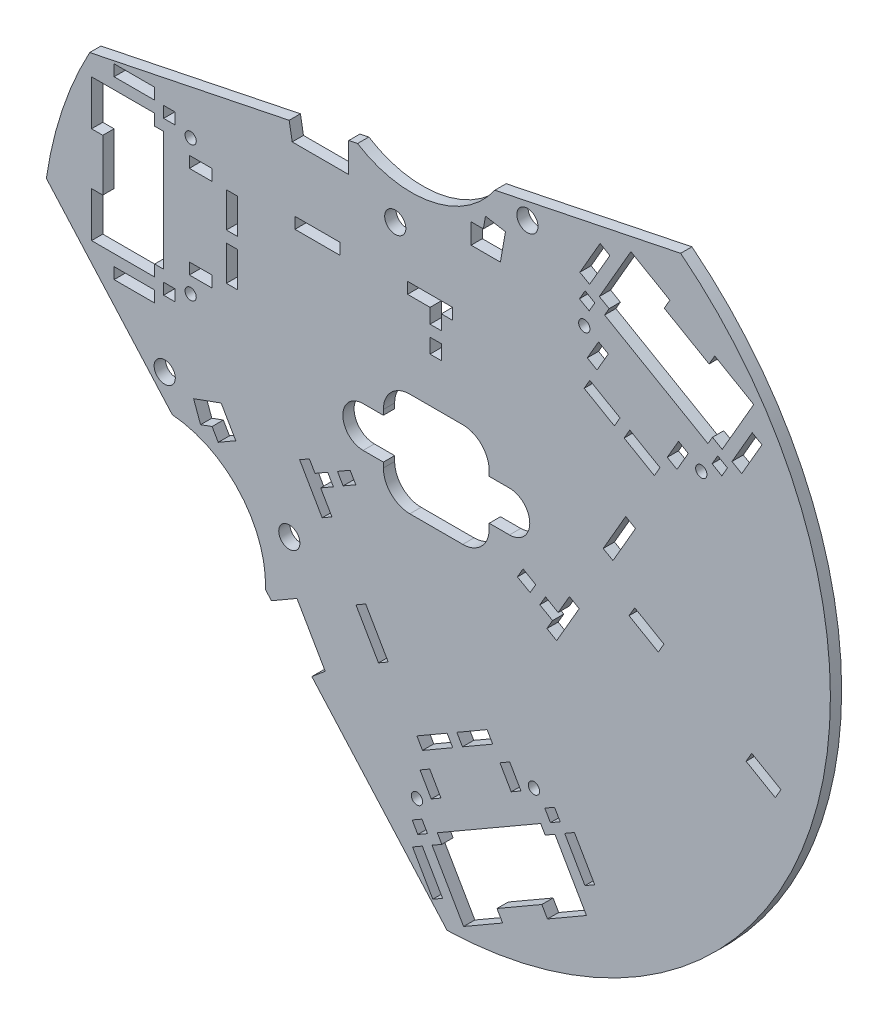
from build123d import *

# Parameters (mm, degrees)
ESQUISSE1_R             = 175
BOSS_EXTRU_1_DEPTH      = 5
ESQUISSE2_W             = 5
ESQUISSE2_H             = 6.5
ESQUISSE2_W_2           = 20
ESQUISSE2_H_2           = 5
ESQUISSE2_H_3           = 15.5
ESQUISSE2_W_3           = 10
ESQUISSE2_W_4           = 18
ESQUISSE2_H_4           = 20
ENL_V_MAT_EXTRU_1_DEPTH = 5
ENL_V_MAT_EXTRU_2_DEPTH = 5
ESQUISSE4_R             = 2.5
ENL_V_MAT_EXTRU_3_DEPTH = 5
ESQUISSE5_R             = 4.7
ENL_V_MAT_EXTRU_4_DEPTH = 5
BOSS_EXTRU_2_DEPTH      = 5
ENL_V_MAT_EXTRU_5_DEPTH = 5
ENL_V_MAT_EXTRU_6_DEPTH = 10


with BuildPart() as part:
    # Esquisse1 → Boss.-Extru.1 (new body)
    with BuildSketch(Plane.XY):
        with Locations((148.080426897, -12.110171348)):
            Circle(ESQUISSE1_R)
    extrude(amount=BOSS_EXTRU_1_DEPTH)

    # Esquisse2 → Enlèv. mat.-Extru.1 (cut)
    with BuildSketch(Plane(origin=(0, 0, 0), x_dir=(-1, 0, 0), z_dir=(0, 0, -1))):
        Polygon((-155.311788567, 53.777441362), (-135.311788567, 53.777441362), (-135.311788567, 48.777441362), (-145.311788567, 48.777441362), (-145.311788567, 42.277441362), (-150.311788567, 42.277441362), (-150.311788567, 48.777441362), (-155.311788567, 48.777441362), align=None)
        with Locations((-147.811788567, 34.027441362)):
            Rectangle(ESQUISSE2_W, ESQUISSE2_H)
        with Locations((-95.311788567, 51.277441362)):
            Rectangle(ESQUISSE2_W_2, ESQUISSE2_H_2)
        with Locations((-57.36, 41.027441362)):
            Rectangle(ESQUISSE2_W, ESQUISSE2_H_3)
        with Locations((-57.36, 20.527441362)):
            Rectangle(ESQUISSE2_W, ESQUISSE2_H_3)
        with Locations((-43.43, 10.277441362)):
            Rectangle(ESQUISSE2_W_3, ESQUISSE2_H_2)
        with Locations((-29.5, -3.222558638)):
            Rectangle(ESQUISSE2_W, ESQUISSE2_H_2)
        with Locations((-14, -8.222558638)):
            Rectangle(ESQUISSE2_W_4, ESQUISSE2_H_2)
        with Locations((2.5, 9.277441362)):
            Rectangle(ESQUISSE2_W, ESQUISSE2_H_4)
        with Locations((2.5, 52.277441362)):
            Rectangle(ESQUISSE2_W, ESQUISSE2_H_4)
        with Locations((-14, 69.777441362)):
            Rectangle(ESQUISSE2_W_4, ESQUISSE2_H_2)
        with Locations((-29.5, 64.777441362)):
            Rectangle(ESQUISSE2_W, ESQUISSE2_H_2)
        with Locations((-43.43, 51.277441362)):
            Rectangle(ESQUISSE2_W_3, ESQUISSE2_H_2)
        Polygon((-87.404399659, -38.791434793), (-97.404399659, -56.111942869), (-101.734526678, -53.611942869), (-96.734526678, -44.951688831), (-102.363691803, -41.701688831), (-99.863691803, -37.371561812), (-94.234526678, -40.621561812), (-91.734526678, -36.291434793), align=None)
        Polygon((-104.193818822, -34.871561812), (-106.693818822, -39.201688831), (-112.322983946, -35.951688831), (-109.822983946, -31.621561812), align=None)
        Polygon((-112.404399659, -82.092704982), (-122.404399659, -99.413213058), (-126.734526678, -96.913213058), (-116.734526678, -79.592704982), align=None)
        Polygon((-139.460420962, -118.955108529), (-141.960420962, -123.285235548), (-155.38381472, -115.535235548), (-152.88381472, -111.205108529), align=None)
        Polygon((-157.213941739, -108.705108529), (-159.713941739, -113.035235548), (-173.137335498, -105.285235548), (-170.637335498, -100.955108529), align=None)
        Polygon((-176.352335498, -110.853778894), (-181.352335498, -119.514032932), (-185.682462517, -117.014032932), (-180.682462517, -108.353778894), align=None)
        Polygon((-196.258678449, -118.332576278), (-198.758678449, -122.662703297), (-203.088805468, -120.162703297), (-200.588805468, -115.832576278), align=None)
        Polygon((-205.088805468, -123.626804912), (-214.088805468, -139.215262181), (-218.418932487, -136.715262181), (-209.418932487, -121.126804912), align=None)
        Polygon((-212.258678449, -146.045389199), (-214.758678449, -150.375516218), (-197.438170373, -160.375516218), (-194.938170373, -156.045389199), align=None)
        Polygon((-175.019586086, -167.545389199), (-177.519586086, -171.875516218), (-160.199078011, -181.875516218), (-157.699078011, -177.545389199), align=None)
        Polygon((-141.868950992, -160.126804912), (-150.868950992, -175.715262181), (-146.538823973, -178.215262181), (-137.538823973, -162.626804912), align=None)
        Polygon((-139.868950992, -156.662703297), (-137.368950992, -152.332576278), (-141.699078011, -149.832576278), (-144.199078011, -154.162703297), align=None)
        Polygon((-145.845293943, -140.014032932), (-140.845293943, -131.353778894), (-145.175420962, -128.853778894), (-150.175420962, -137.514032932), align=None)
        Polygon((-201.525092463, -51.316520615), (-211.525092463, -33.996012539), (-207.194965444, -31.496012539), (-202.194965444, -40.156266577), (-196.56580032, -36.906266577), (-194.06580032, -41.236393596), (-199.694965444, -44.486393596), (-197.194965444, -48.816520615), align=None)
        Polygon((-189.735673301, -38.736393596), (-192.235673301, -34.406266577), (-186.606508176, -31.156266577), (-184.106508176, -35.486393596), align=None)
        Polygon((-226.525092463, -8.015250425), (-236.525092463, 9.30525765), (-232.194965444, 11.80525765), (-222.194965444, -5.515250425), align=None)
        Polygon((-244.920859728, 33.847153121), (-247.420859728, 38.17728014), (-233.997465969, 45.92728014), (-231.497465969, 41.597153121), align=None)
        Polygon((-227.16733895, 44.097153121), (-229.66733895, 48.42728014), (-216.243945192, 56.17728014), (-213.743945192, 51.847153121), align=None)
        Polygon((-219.458945192, 61.745823487), (-224.458945192, 70.406077524), (-220.128818173, 72.906077524), (-215.128818173, 64.245823487), align=None)
        Polygon((-215.982602241, 82.724620871), (-218.482602241, 87.05474789), (-214.152475222, 89.55474789), (-211.652475222, 85.224620871), align=None)
        Polygon((-216.152475222, 93.018849505), (-225.152475222, 108.607306773), (-220.822348203, 111.107306773), (-211.822348203, 95.518849505), align=None)
        Polygon((-231.982602241, 110.437433792), (-234.482602241, 114.767560811), (-251.803110316, 104.767560811), (-249.303110316, 100.437433792), align=None)
        Polygon((-269.221694603, 88.937433792), (-271.721694603, 93.267560811), (-289.042202679, 83.267560811), (-286.542202679, 78.937433792), align=None)
        Polygon((-279.372329698, 56.518849505), (-288.372329698, 72.107306773), (-292.702456717, 69.607306773), (-283.702456717, 54.018849505), align=None)
        Polygon((-277.372329698, 53.05474789), (-274.872329698, 48.724620871), (-270.542202679, 51.224620871), (-273.042202679, 55.55474789), align=None)
        Polygon((-259.965986747, 49.906077524), (-254.965986747, 41.245823487), (-250.635859728, 43.745823487), (-255.635859728, 52.406077524), align=None)
    extrude(amount=-ENL_V_MAT_EXTRU_1_DEPTH, mode=Mode.SUBTRACT)

    # Esquisse3 → Enlèv. mat.-Extru.2 (cut)
    with BuildSketch(Plane(origin=(0, 0, 0), x_dir=(-1, 0, 0), z_dir=(0, 0, -1))):
        Polygon((0, -0.722558638), (-23, -0.722558638), (-23, 4.277441362), (-27, 4.277441362), (-27, 57.277441362), (-23, 57.277441362), (-23, 62.277441362), (0, 62.277441362), align=None)
        Polygon((-212.258678449, -146.045389199), (-200.758678449, -126.126804912), (-196.42855143, -128.626804912), (-194.42855143, -125.162703297), (-148.52920503, -151.662703297), (-150.52920503, -155.126804912), (-146.199078011, -157.626804912), (-157.699078011, -177.545389199), align=None)
        Polygon((-231.982602241, 110.437433792), (-220.482602241, 90.518849505), (-224.81272926, 88.018849505), (-222.81272926, 84.55474789), (-268.71207566, 58.05474789), (-270.71207566, 61.518849505), (-275.042202679, 59.018849505), (-286.542202679, 78.937433792), align=None)
    extrude(amount=-ENL_V_MAT_EXTRU_2_DEPTH, mode=Mode.SUBTRACT)

    # Esquisse4 → Enlèv. mat.-Extru.3 (cut)
    with BuildSketch(Plane(origin=(0, 0, 0), x_dir=(-1, 0, 0), z_dir=(0, 0, -1))):
        with Locations((-39, 60.777441362)):
            Circle(ESQUISSE4_R)
        with Locations(Location((-39, 0.777441362, 0), (0, 0, 180))):
            Circle(ESQUISSE4_R)
        with Locations((-139.498116116, -143.020398452)):
            Circle(ESQUISSE4_R)
        with Locations(Location((-191.459640343, -113.020398452, 0), (0, 0, 180))):
            Circle(ESQUISSE4_R)
        with Locations((-265.743164573, 45.912443044)):
            Circle(ESQUISSE4_R)
        with Locations(Location((-213.781640346, 75.912443044, 0), (0, 0, 180))):
            Circle(ESQUISSE4_R)
    extrude(amount=-ENL_V_MAT_EXTRU_3_DEPTH, mode=Mode.SUBTRACT)

    # Esquisse5 → Enlèv. mat.-Extru.4 (cut)
    with BuildSketch(Plane(origin=(0, 0, 0), x_dir=(-1, 0, 0), z_dir=(0, 0, -1))):
        with Locations((-188.54080573, 103.777441362)):
            Circle(ESQUISSE5_R)
        with Locations((-129.859999997, 73.777441362)):
            Circle(ESQUISSE5_R)
        with Locations((-27.488620889, -35.014261787)):
            Circle(ESQUISSE5_R)
        with Locations((-82.809785869, -70.833330267)):
            Circle(ESQUISSE5_R)
        Polygon((9.512961524, 70.443622585), (-93.474910733, 91.632672923), (-94.859999997, 83.777441362), (-174.859999997, 83.777441362), (-179.360865983, 109.303120805), (-315.699146075, 137.353789457), (-290.786999001, 258.437508623), (34.425108598, 191.527341751), align=None)
        Polygon((-233.671367804, -25.637538451), (-246.66174886, -33.137538451), (-249.16174886, -28.807411432), (-236.171367804, -21.307411432), align=None)
        Polygon((-155.383438382, -189.866946156), (-85.539246378, -111.271357669), (-91.649531831, -106.144219399), (-51.649531831, -36.862187096), (-27.293211991, -45.727162534), (65.168519701, 58.319917207), (157.574022946, -23.796494605), (-62.977935137, -271.983357968), align=None)
        Polygon((-285.632892031, -55.637538451), (-298.623273088, -63.137538451), (-301.123273088, -58.807411432), (-288.132892031, -51.307411432), align=None)
    extrude(amount=-ENL_V_MAT_EXTRU_4_DEPTH, mode=Mode.SUBTRACT)

    # Esquisse6 → Boss.-Extru.2 (add)
    with BuildSketch(Plane(origin=(0, 0, 0), x_dir=(-1, 0, 0), z_dir=(0, 0, -1))):
        with BuildLine():
            Line((-72.219328665, -96.282469671), (-85.539246378, -111.271357669))
            Line((-85.539246378, -111.271357669), (-94.478128434, -107.364683264))
            Line((-94.478128434, -107.364683264), (-52.020767653, -31.413182311))
            Line((-52.020767653, -31.413182311), (-27.293211991, -45.727162534))
            Line((-27.293211991, -45.727162534), (-30.866030993, -49.747651624))
            ThreePointArc((-30.866030993, -49.747651624), (-60.888072009, -64.710251454), (-72.219328665, -96.282469671))
        make_face()
        with BuildLine():
            Line((-113.11562737, 95.67361604), (-93.474910733, 91.632672923))
            Line((-93.474910733, 91.632672923), (-92.388748984, 81.938036779))
            Line((-92.388748984, 81.938036779), (-179.393358655, 80.731439317))
            Line((-179.393358655, 80.731439317), (-179.360865983, 109.303120805))
            Line((-179.360865983, 109.303120805), (-174.092610795, 108.219213332))
            ThreePointArc((-174.092610795, 108.219213332), (-146.123598727, 89.700663053), (-113.11562737, 95.67361604))
        make_face()
    extrude(amount=-BOSS_EXTRU_2_DEPTH)

    # Esquisse7 → Enlèv. mat.-Extru.5 (cut)
    with BuildSketch(Plane(origin=(0, 0, 0), x_dir=(-1, 0, 0), z_dir=(0, 0, -1))):
        Polygon((-109.197691521, 94.867527535), (-109.197691521, 81.777441362), (-84.10034763, 81.777441362), (-82.751624535, 89.426430129), align=None)
        Polygon((-74.876389713, -99.272457394), (-86.212736876, -92.727414308), (-98.761408822, -114.462351685), (-92.811551784, -119.454874531), align=None)
        Polygon((-163.538199262, 81.777441362), (-176.538199262, 81.777441362), (-178.795625572, 94.579942151), (-169.932355795, 96.14277575), (-168.986302582, 90.777441362), (-163.538199262, 90.777441362), align=None)
        Polygon((-59.042483006, -45.667154149), (-52.542483006, -34.4088239), (-40.326478935, -38.855085763), (-43.404660225, -47.31231935), (-48.524202712, -45.448958272), (-51.248254372, -50.167154149), align=None)
    extrude(amount=-ENL_V_MAT_EXTRU_5_DEPTH, mode=Mode.SUBTRACT)

    # Esquisse9 → Enlèv. mat.-Extru.6 (cut)
    with BuildSketch(Plane.XY.offset(5)):
        with BuildLine():
            Line((180.580426897, -21.110171348), (171.580426897, -21.110171348))
            Line((171.580426897, -21.110171348), (171.580426897, -23.360171348))
            ThreePointArc((171.580426897, -23.360171348), (168.138931576, -31.668676027), (159.830426897, -35.110171348))
            Line((159.830426897, -35.110171348), (136.330426897, -35.110171348))
            ThreePointArc((136.330426897, -35.110171348), (128.021922218, -31.668676027), (124.580426897, -23.360171348))
            Line((124.580426897, -23.360171348), (124.580426897, -21.110171348))
            Line((124.580426897, -21.110171348), (115.580426897, -21.110171348))
            ThreePointArc((115.580426897, -21.110171348), (106.580426897, -12.110171348), (115.580426897, -3.110171348))
            Line((115.580426897, -3.110171348), (124.580426897, -3.110171348))
            Line((124.580426897, -3.110171348), (124.580426897, -0.860171348))
            ThreePointArc((124.580426897, -0.860171348), (128.021922218, 7.44833333), (136.330426897, 10.889828652))
            Line((136.330426897, 10.889828652), (159.830426897, 10.889828652))
            ThreePointArc((159.830426897, 10.889828652), (168.138931576, 7.44833333), (171.580426897, -0.860171348))
            Line((171.580426897, -0.860171348), (171.580426897, -3.110171348))
            Line((171.580426897, -3.110171348), (180.580426897, -3.110171348))
            ThreePointArc((180.580426897, -3.110171348), (189.580426897, -12.110171348), (180.580426897, -21.110171348))
        make_face()
    extrude(amount=-ENL_V_MAT_EXTRU_6_DEPTH, mode=Mode.SUBTRACT)


solid = part.part
